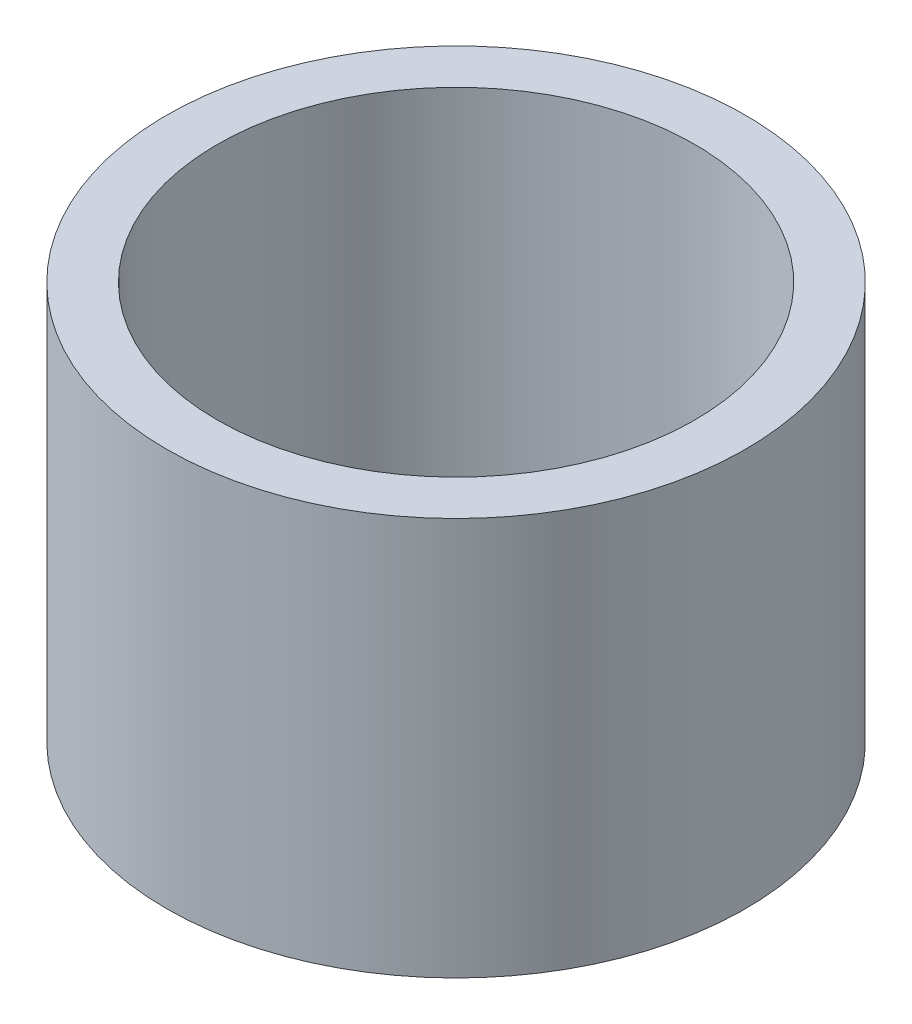
from build123d import *

# Parameters (mm, degrees)
SKETCH1_R           = 4
SKETCH1_R_2         = 3.3
BOSS_EXTRUDE1_DEPTH = 5.5


with BuildPart() as part:
    # Sketch1 → Boss-Extrude1 (new body)
    with BuildSketch(Plane(origin=(0, 0, 0), x_dir=(1, 0, 0), z_dir=(0, 1, 0))):
        with Locations(Location((0, 0, 0), (0, 0, 270))):
            Circle(SKETCH1_R)
        with Locations(Location((0, 0, 0), (0, 0, 270))):
            Circle(SKETCH1_R_2, mode=Mode.SUBTRACT)
    extrude(amount=BOSS_EXTRUDE1_DEPTH)


solid = part.part
